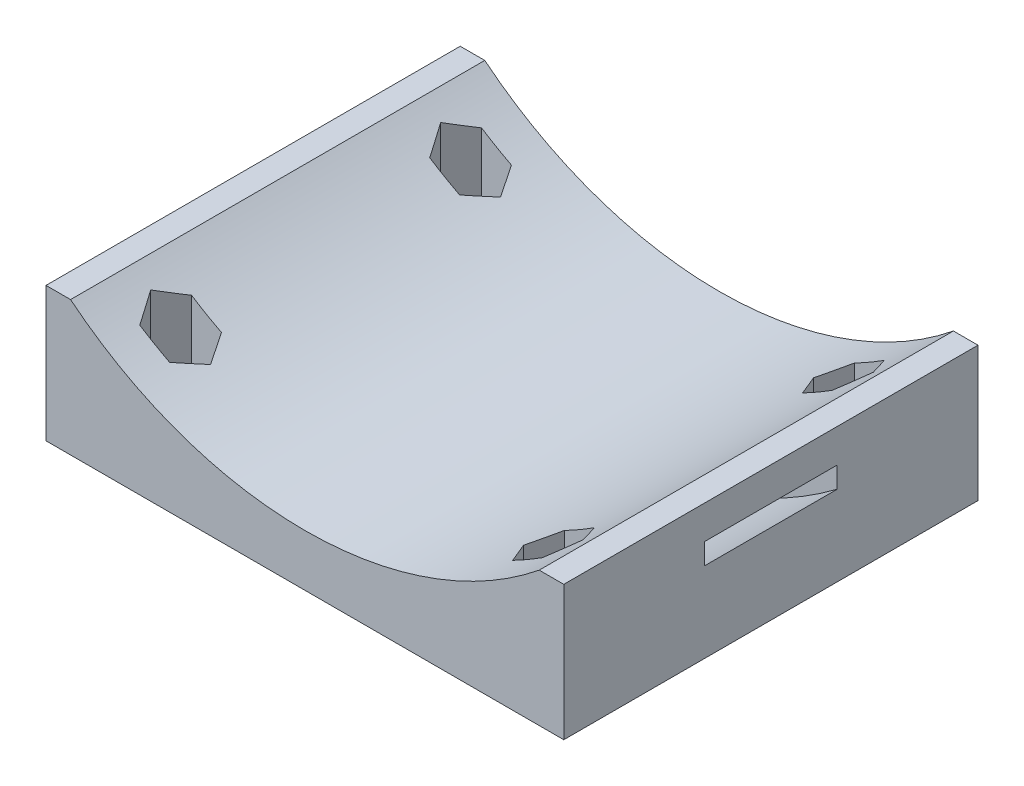
from build123d import *

# Parameters (mm, degrees)
BOSS_EXTRUDE1_DEPTH   = 63.5
SKETCH2_W             = 127
SKETCH2_H             = 12.7
CUT_EXTRUDE1_DEPTH    = 80.596939718
SKETCH3_W             = 20.32
SKETCH3_H             = 2.54
F_6_CLEARANCE_HOLE1_D = 3.7973
CUT_EXTRUDE2_DEPTH    = 22.225


with BuildPart() as part:
    # Sketch1 → Boss-Extrude1 (new body)
    with BuildSketch(Plane.XY):
        with BuildLine():
            Line((-39.6875, -3.022072464), (-39.6875, -26.9875))
            Line((-39.6875, -26.9875), (39.6875, -26.9875))
            Line((39.6875, -26.9875), (39.6875, -3.022072464))
            ThreePointArc((39.6875, -3.022072464), (0, -19.05), (-39.6875, -3.022072464))
        make_face()
    extrude(amount=BOSS_EXTRUDE1_DEPTH)

    # Sketch2 → Cut-Extrude1 (cut, through all)
    with BuildSketch(Plane.XY.offset(63.5)):
        Rectangle(SKETCH2_W, SKETCH2_H)
    extrude(amount=-CUT_EXTRUDE1_DEPTH, mode=Mode.SUBTRACT)

    # Sketch3 → Cut-Revolve1 (revolve, cut)
    with BuildSketch(Plane(origin=(0, 0, 0), x_dir=(0, 0, -1), z_dir=(1, 0, 0))):
        with Locations((-31.75, -26.67)):
            Rectangle(SKETCH3_W, SKETCH3_H)
    revolve(axis=Axis((0, 38.1, 16.404698597), (0, 0, 1)), mode=Mode.SUBTRACT)

    # #6 Clearance Hole1 (through all)
    with Locations(Plane(origin=(0, -26.9875, 0), x_dir=(-1, 0, 0), z_dir=(0, -1, 0))):
        with Locations((-28.575, -9.525), (-28.575, -53.975)):
            f_6_clearance_hole1 = Hole(F_6_CLEARANCE_HOLE1_D / 2)

    # Sketch10 → Cut-Extrude2 (cut)
    with BuildSketch(Plane(origin=(0, 0, 0), x_dir=(1, 0, 0), z_dir=(0, 1, 0))):
        Polygon((23.992282238, -9.525), (26.283641119, -13.49375), (30.866358881, -13.49375), (33.157717762, -9.525), (30.866358881, -5.55625), (26.283641119, -5.55625), align=None)
        Polygon((23.992282238, -53.975), (26.283641119, -57.94375), (30.866358881, -57.94375), (33.157717762, -53.975), (30.866358881, -50.00625), (26.283641119, -50.00625), align=None)
    cut_extrude2 = extrude(amount=-CUT_EXTRUDE2_DEPTH, mode=Mode.SUBTRACT)

    # Mirror1: #6 Clearance Hole1, Cut-Extrude2 across plane
    add(f_6_clearance_hole1.mirror(Plane(origin=(0, 0, 0), x_dir=(0, 0, 1), z_dir=(1, 0, 0))), mode=Mode.SUBTRACT)
    add(cut_extrude2.mirror(Plane(origin=(0, 0, 0), x_dir=(0, 0, 1), z_dir=(1, 0, 0))), mode=Mode.SUBTRACT)


solid = part.part
